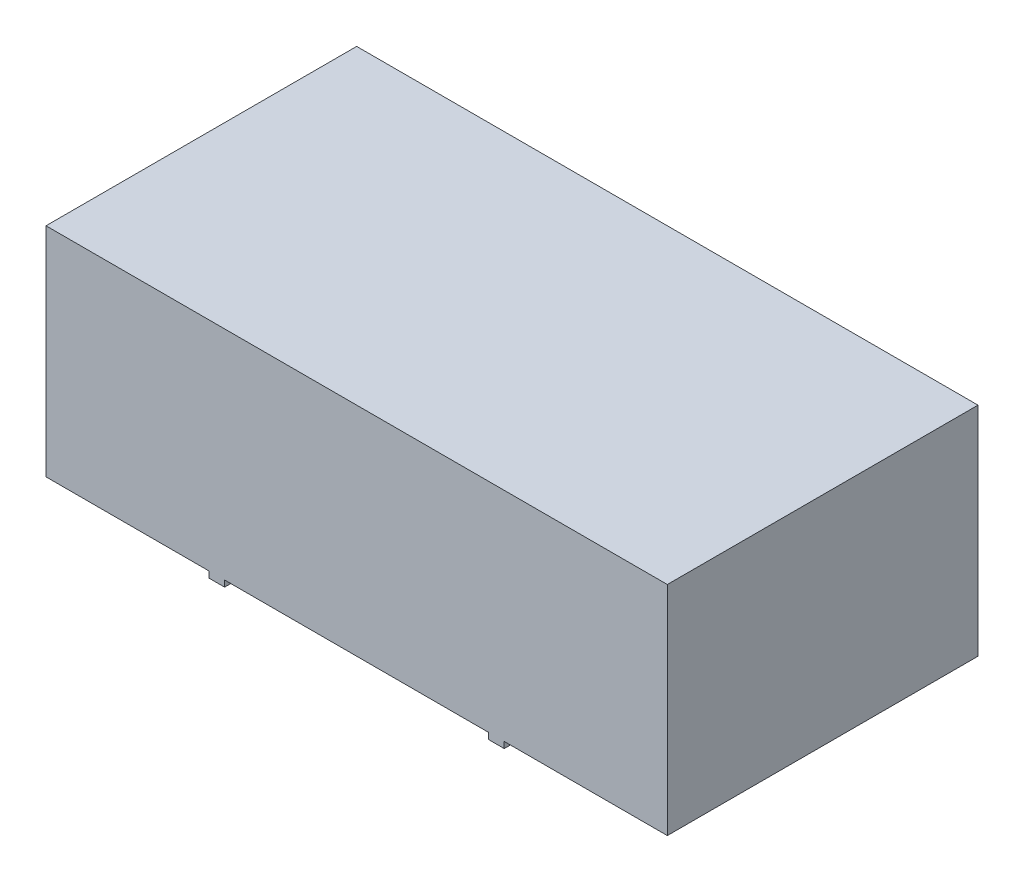
from build123d import *

# Parameters (mm, degrees)
SKETCH1_W           = 200
SKETCH1_H           = 100
BOSS_EXTRUDE1_DEPTH = 70
SKETCH2_W           = 5
SKETCH2_H           = 100
BOSS_EXTRUDE2_DEPTH = 2


with BuildPart() as part:
    # Sketch1 → Boss-Extrude1 (new body)
    with BuildSketch(Plane(origin=(0, 0, 0), x_dir=(1, 0, 0), z_dir=(0, 1, 0))):
        Rectangle(SKETCH1_W, SKETCH1_H)
    extrude(amount=BOSS_EXTRUDE1_DEPTH)

    # Sketch2 → Boss-Extrude2 (add)
    with BuildSketch(Plane.XZ):
        with Locations((-45, 0)):
            Rectangle(SKETCH2_W, SKETCH2_H)
        with Locations((45, 0)):
            Rectangle(SKETCH2_W, SKETCH2_H)
    extrude(amount=BOSS_EXTRUDE2_DEPTH)


solid = part.part
